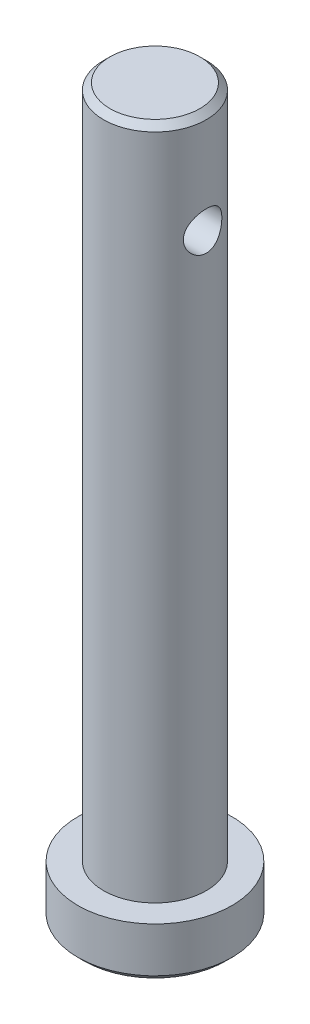
from build123d import *

# Parameters (mm, degrees)
SKETCH1_R               = 12
BOSS_EXTRUDE1_DEPTH     = 8
CHAMFER1_SIZE           = 1
SKETCH2_R               = 8
BOSS_EXTRUDE2_DEPTH     = 105
CHAMFER2_SIZE           = 1
CUT_EXTRUDE1_DEPTH      = 115.267230648
CUT_EXTRUDE1_DEPTH_BACK = 115.267230648
SKETCH3_R               = 3


with BuildPart() as part:
    # Sketch1 → Boss-Extrude1 (new body)
    with BuildSketch(Plane(origin=(0, 0, 0), x_dir=(-1, 0, 0), z_dir=(0, 1, 0))):
        with Locations(Location((0, 0, 0), (0, 0, 90))):
            Circle(SKETCH1_R)
    extrude(amount=BOSS_EXTRUDE1_DEPTH)

    # Chamfer1
    chamfer1_edges = [part.edges().sort_by_distance(p)[0] for p in [
        (0, 0, -12),
    ]]
    chamfer(chamfer1_edges, length=CHAMFER1_SIZE)

    # Sketch2 → Boss-Extrude2 (add)
    with BuildSketch(Plane(origin=(0, 8, 0), x_dir=(-1, 0, 0), z_dir=(0, 1, 0))):
        with Locations(Location((0, 0, 0), (0, 0, 90))):
            Circle(SKETCH2_R)
    extrude(amount=BOSS_EXTRUDE2_DEPTH)

    # Chamfer2
    chamfer2_edges = [part.edges().sort_by_distance(p)[0] for p in [
        (0, 113, -8),
    ]]
    chamfer(chamfer2_edges, length=CHAMFER2_SIZE)

    # Sketch3 → Cut-Extrude1 (cut, two sides: drawn at the far end of the back side and taken through both)
    with BuildSketch(Plane.YZ.offset(-CUT_EXTRUDE1_DEPTH_BACK)):
        with Locations(Location((97, 0, 0), (0, 0, 270))):
            Circle(SKETCH3_R)
    extrude(amount=CUT_EXTRUDE1_DEPTH + CUT_EXTRUDE1_DEPTH_BACK, mode=Mode.SUBTRACT)


solid = part.part
